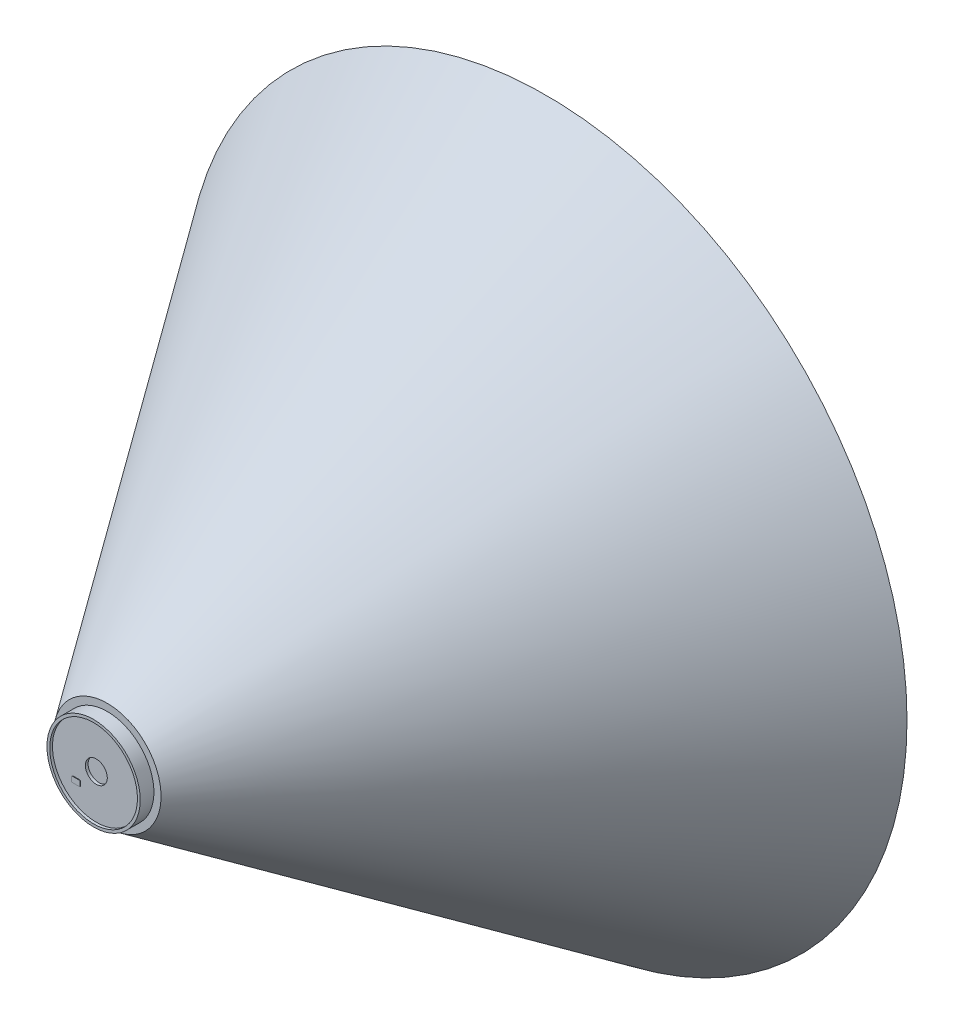
from build123d import *

# Parameters (mm, degrees)
CROQUIS1_R              = 400
CROQUIS1_R_2            = 100
SALIENTE_EXTRUIR1_DEPTH = 100
CROQUIS2_R              = 425
CROQUIS2_R_2            = 400
SALIENTE_EXTRUIR2_DEPTH = 125
CROQUIS3_R              = 100
SALIENTE_EXTRUIR3_DEPTH = 75
CROQUIS5_W              = 75
CROQUIS5_H              = 50
SALIENTE_EXTRUIR4_DEPTH = 5
REDONDEO1_R             = 5


with BuildPart() as part:
    # Croquis1 → Saliente-Extruir1 (new body)
    with BuildSketch(Plane.XY):
        Circle(CROQUIS1_R)
        Circle(CROQUIS1_R_2, mode=Mode.SUBTRACT)
    extrude(amount=SALIENTE_EXTRUIR1_DEPTH)



with BuildPart() as body_2:
    # Croquis2 → Saliente-Extruir2 (new body)
    with BuildSketch(Plane.XY):
        Circle(CROQUIS2_R)
        Circle(CROQUIS2_R_2, mode=Mode.SUBTRACT)
    extrude(amount=SALIENTE_EXTRUIR2_DEPTH)


with BuildPart() as body_3:
    # Croquis3 → Saliente-Extruir3 (new body)
    with BuildSketch(Plane.XY):
        Circle(CROQUIS3_R)
    extrude(amount=SALIENTE_EXTRUIR3_DEPTH)


with BuildPart() as part_1:
    add(part.part)

    add(body_2.part)  # Saliente-Extruir4 merges body 2
    # Croquis5 → Saliente-Extruir4 (add)
    with BuildSketch(Plane.XY.offset(100)):
        with Locations((-182.5, -165)):
            Rectangle(CROQUIS5_W, CROQUIS5_H)
    extrude(amount=SALIENTE_EXTRUIR4_DEPTH)

    # Redondeo1
    redondeo1_edges = [part_1.edges().sort_by_distance(p)[0] for p in [
        (-220, -140, 102.5),
        (-220, -190, 102.5),
        (-145, -190, 102.5),
        (-145, -140, 102.5),
    ]]
    fillet(redondeo1_edges, radius=REDONDEO1_R)


    add(body_3.part)  # Revolución2 merges body 3
    # Croquis6 → Revolución2 (revolve)
    with BuildSketch(Plane(origin=(0, 0, 0), x_dir=(1, 0, 0), z_dir=(0, 1, 0))):
        Polygon((-490.113460198, 0), (-3290.943613037, 4000), (0, 4000), (0, 0), align=None)
    revolve(axis=Axis((0, 0, 0), (0, 0, -1)))


solid = part_1.part
